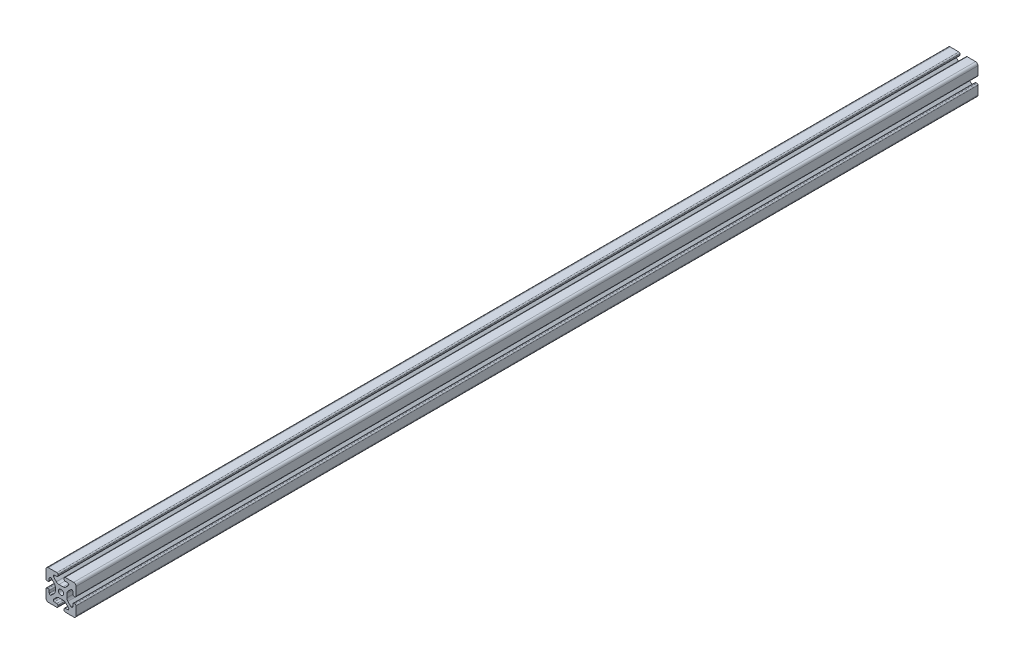
from build123d import *

# Parameters (mm, degrees)
SKETCH1_R      = 3.4
EXTRUDE1_DEPTH = 1200


with BuildPart() as part:
    # Sketch1 → Extrude1 (new body)
    with BuildSketch(Plane.XY):
        with BuildLine():
            Line((-8.715, -15.524615034), (-5.63, -15.524615034))
            ThreePointArc((-5.63, -15.524615034), (-4.519842354, -15.984457388), (-4.06, -17.094615034))
            Line((-4.06, -17.094615034), (-4.06, -18.43))
            ThreePointArc((-4.06, -18.43), (-4.519842354, -19.540157646), (-5.63, -20))
            Line((-5.63, -20), (-16.674615034, -20))
            ThreePointArc((-16.674615034, -20), (-18.951578385, -19.194274381), (-20, -17.018368134))
            Line((-20, -17.018368134), (-20, -5.757918808))
            ThreePointArc((-20, -5.757918808), (-19.564709668, -4.603883664), (-18.43, -4.120449326))
            Line((-18.43, -4.120449326), (-17.25, -4.120449326))
            ThreePointArc((-17.25, -4.120449326), (-16.115287682, -4.60388249), (-15.67999625, -5.757919334))
            Line((-15.67999625, -5.757919334), (-15.67999625, -8.715399492))
            ThreePointArc((-15.67999625, -8.715399492), (-15.220153896, -9.825557139), (-14.10999625, -10.285399492))
            Line((-14.10999625, -10.285399492), (-13.816898819, -10.285399492))
            ThreePointArc((-13.816898819, -10.285399492), (-13.526061711, -10.227547119), (-13.279501941, -10.062800646))
            Line((-13.279501941, -10.062800646), (-9.076242789, -5.859541495))
            ThreePointArc((-9.076242789, -5.859541495), (-8.046572221, -4.318530588), (-7.685, -2.500784284))
            Line((-7.685, -2.500784284), (-7.685, 2.500784284))
            ThreePointArc((-7.685, 2.500784284), (-8.046572221, 4.318530588), (-9.076242789, 5.859541495))
            Line((-9.076242789, 5.859541495), (-13.040489136, 9.823787841))
            ThreePointArc((-13.040489136, 9.823787841), (-13.354224618, 10.012729352), (-13.71989919, 10.033001362))
            Line((-13.71989919, 10.033001362), (-14.05520779, 10.044710596))
            ThreePointArc((-14.05520779, 10.044710596), (-15.200613642, 9.605030484), (-15.68, 8.475666998))
            Line((-15.68, 8.475666998), (-15.68, 5.572979049))
            ThreePointArc((-15.68, 5.572979049), (-16.139842354, 4.462821403), (-17.25, 4.002979049))
            Line((-17.25, 4.002979049), (-18.43, 4.002979049))
            ThreePointArc((-18.43, 4.002979049), (-19.540157646, 4.462821403), (-20, 5.572979049))
            Line((-20, 5.572979049), (-20, 13.004526564))
            Line((-20, 13.004526564), (-20, 16.83))
            ThreePointArc((-20, 16.83), (-19.071528496, 19.071528496), (-16.83, 20))
            Line((-16.83, 20), (-5.63, 20))
            ThreePointArc((-5.63, 20), (-4.519842354, 19.540157646), (-4.06, 18.43))
            Line((-4.06, 18.43), (-4.06, 17.094615034))
            ThreePointArc((-4.06, 17.094615034), (-4.519842354, 15.984457388), (-5.63, 15.524615034))
            Line((-5.63, 15.524615034), (-8.715, 15.524615034))
            ThreePointArc((-8.715, 15.524615034), (-9.825157646, 15.06477268), (-10.285, 13.954615034))
            Line((-10.285, 13.954615034), (-10.285, 13.492503602))
            ThreePointArc((-10.285, 13.492503602), (-10.227148445, 13.201664194), (-10.062401154, 12.955102448))
            Line((-10.062401154, 12.955102448), (-6.217092793, 9.109794088))
            ThreePointArc((-6.217092793, 9.109794088), (-4.63891877, 8.055291919), (-2.777335583, 7.685))
            Line((-2.777335583, 7.685), (2.777335583, 7.685))
            ThreePointArc((2.777335583, 7.685), (4.63891877, 8.055291919), (6.217092793, 9.109794088))
            Line((6.217092793, 9.109794088), (10.062401154, 12.955102448))
            ThreePointArc((10.062401154, 12.955102448), (10.227148445, 13.201664194), (10.285, 13.492503602))
            Line((10.285, 13.492503602), (10.285, 13.954615034))
            ThreePointArc((10.285, 13.954615034), (9.825157646, 15.06477268), (8.715, 15.524615034))
            Line((8.715, 15.524615034), (5.63, 15.524615034))
            ThreePointArc((5.63, 15.524615034), (4.519842354, 15.984457388), (4.06, 17.094615034))
            Line((4.06, 17.094615034), (4.06, 18.43))
            ThreePointArc((4.06, 18.43), (4.519842354, 19.540157646), (5.63, 20))
            Line((5.63, 20), (12.979635074, 20))
            Line((12.979635074, 20), (16.83, 20))
            ThreePointArc((16.83, 20), (19.071528496, 19.071528496), (20, 16.83))
            Line((20, 16.83), (20, 13.001098436))
            Line((20, 13.001098436), (20, 5.63))
            ThreePointArc((20, 5.63), (19.540157461, 4.519842693), (18.43, 4.060000526))
            Line((18.43, 4.060000526), (17.24999625, 4.060000526))
            ThreePointArc((17.24999625, 4.060000526), (16.139838603, 4.519842879), (15.67999625, 5.630000526))
            Line((15.67999625, 5.630000526), (15.67999625, 8.715399492))
            ThreePointArc((15.67999625, 8.715399492), (15.220153896, 9.825557139), (14.10999625, 10.285399492))
            Line((14.10999625, 10.285399492), (13.816903094, 10.285399492))
            ThreePointArc((13.816903094, 10.285399492), (13.526063686, 10.227547937), (13.279501941, 10.062800646))
            Line((13.279501941, 10.062800646), (9.076242789, 5.859541495))
            ThreePointArc((9.076242789, 5.859541495), (8.046572221, 4.318530588), (7.685, 2.500784284))
            Line((7.685, 2.500784284), (7.685, -2.500784284))
            ThreePointArc((7.685, -2.500784284), (8.046572221, -4.318530588), (9.076242789, -5.859541495))
            Line((9.076242789, -5.859541495), (13.163657296, -9.946956002))
            ThreePointArc((13.163657296, -9.946956002), (13.35903797, -10.160433474), (13.6200547, -10.285399492))
            Line((13.6200547, -10.285399492), (14.10999625, -10.285399492))
            ThreePointArc((14.10999625, -10.285399492), (15.220153896, -9.825557139), (15.67999625, -8.715399492))
            Line((15.67999625, -8.715399492), (15.67999625, -5.630000526))
            ThreePointArc((15.67999625, -5.630000526), (16.139838603, -4.519842879), (17.24999625, -4.060000526))
            Line((17.24999625, -4.060000526), (18.43, -4.060000526))
            ThreePointArc((18.43, -4.060000526), (19.540157461, -4.519842693), (20, -5.63))
            Line((20, -5.63), (20, -16.83))
            ThreePointArc((20, -16.83), (19.071528496, -19.071528496), (16.83, -20))
            Line((16.83, -20), (13, -20))
            Line((13, -20), (5.63, -20))
            ThreePointArc((5.63, -20), (4.519842354, -19.540157646), (4.06, -18.43))
            Line((4.06, -18.43), (4.06, -17.094615034))
            ThreePointArc((4.06, -17.094615034), (4.519842354, -15.984457388), (5.63, -15.524615034))
            Line((5.63, -15.524615034), (8.715, -15.524615034))
            ThreePointArc((8.715, -15.524615034), (9.825157646, -15.06477268), (10.285, -13.954615034))
            Line((10.285, -13.954615034), (10.285, -13.492503602))
            ThreePointArc((10.285, -13.492503602), (10.227148445, -13.201664194), (10.062401154, -12.955102448))
            Line((10.062401154, -12.955102448), (6.217092793, -9.109794088))
            ThreePointArc((6.217092793, -9.109794088), (4.63891877, -8.055291919), (2.777335583, -7.685))
            Line((2.777335583, -7.685), (-2.777335583, -7.685))
            ThreePointArc((-2.777335583, -7.685), (-4.63891877, -8.055291919), (-6.217092793, -9.109794088))
            Line((-6.217092793, -9.109794088), (-10.062401154, -12.955102448))
            ThreePointArc((-10.062401154, -12.955102448), (-10.227148445, -13.201664194), (-10.285, -13.492503602))
            Line((-10.285, -13.492503602), (-10.285, -13.954615034))
            ThreePointArc((-10.285, -13.954615034), (-9.825157646, -15.06477268), (-8.715, -15.524615034))
        make_face()
        Circle(SKETCH1_R, mode=Mode.SUBTRACT)
    extrude(amount=-EXTRUDE1_DEPTH)


solid = part.part
